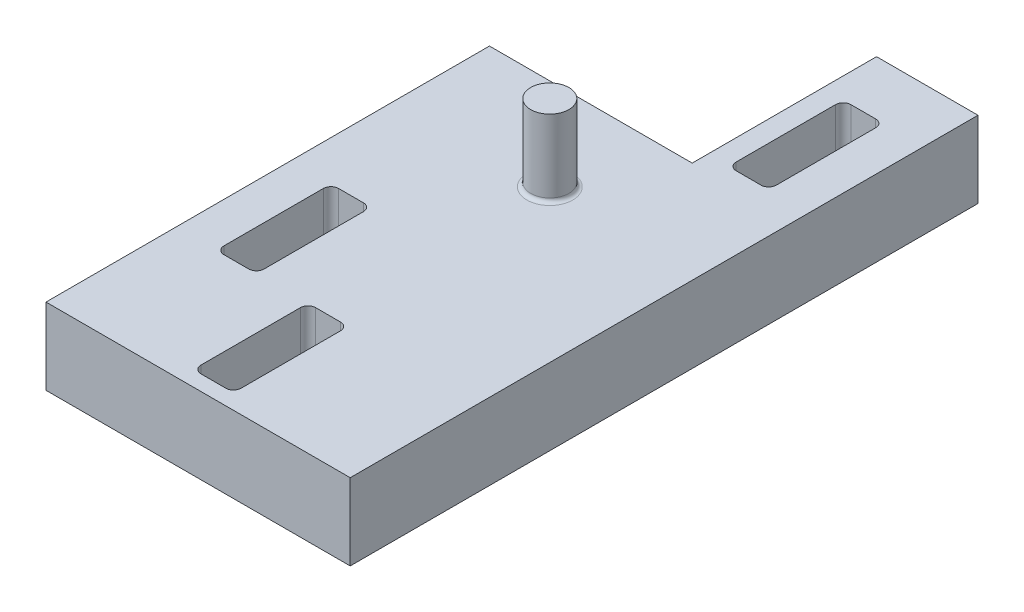
from build123d import *

# Parameters (mm, degrees)
BOSS_EXTRUDE1_DEPTH  = 10
FILLET2_R            = 1
FILLET2_OF_MIRROR1_R = 1
CUT_EXTRUDE1_DEPTH   = 81.635062113
FILLET3_R            = 1
SKETCH5_R            = 2.5
BOSS_EXTRUDE2_DEPTH  = 10
FILLET1_R            = 0.5
CUT_EXTRUDE2_DEPTH   = 10


with BuildPart() as part:
    # Sketch2 → Boss-Extrude1 (new body)
    with BuildSketch(Plane(origin=(0, 0, 0), x_dir=(1, 0, 0), z_dir=(0, 1, 0))):
        Polygon((-19.893799085, 77.5), (0, 77.5), (0, 75.5), (-2.625, 75.5), (-2.625, 73), (-2.625, 63), (-2.625, 60.5), (0, 60.5), (0, 60.375), (0, 2.5), (-2.625, 2.5), (-2.625, 0), (-2.625, -10), (-2.625, -12.5), (0, -12.5), (0, -14.5), (-19.893799085, -14.5), align=None)
    boss_extrude1 = extrude(amount=BOSS_EXTRUDE1_DEPTH)

    # Fillet2
    fillet2_edges = [part.edges().sort_by_distance(p)[0] for p in [
        (-2.625, 5, 12.5),
        (-2.625, 5, -2.5),
        (-2.625, 5, -60.5),
        (-2.625, 5, -75.5),
    ]]
    fillet(fillet2_edges, radius=FILLET2_R)

    # Mirror1: Boss-Extrude1 across Right Plane
    add(boss_extrude1.mirror(Plane(origin=(0, 0, 0), x_dir=(0, 0, -1), z_dir=(1, 0, 0))))

    # Fillet2 of Mirror1
    fillet2_of_mirror1_edges = [part.edges().sort_by_distance(p)[0] for p in [
        (2.625, 5, 12.5),
        (2.625, 5, -2.5),
        (2.625, 5, -60.5),
        (2.625, 5, -75.5),
    ]]
    fillet(fillet2_of_mirror1_edges, radius=FILLET2_OF_MIRROR1_R)

    # Sketch4 → Cut-Extrude1 (cut, through all)
    with BuildSketch(Plane(origin=(0, 0, 0), x_dir=(1, 0, 0), z_dir=(0, 1, 0))):
        Polygon((-14.625, 15), (-14.625, 5), (-14.625, 2.5), (-12, 2.5), (-9.375, 2.5), (-9.375, 5), (-9.375, 15), (-9.375, 17.5), (-12, 17.5), (-14.625, 17.5), align=None)
        Polygon((9.375, 58), (9.375, 48), (9.375, 45.5), (12, 45.5), (14.625, 45.5), (14.625, 48), (14.625, 58), (14.625, 60.5), (12, 60.5), (9.375, 60.5), align=None)
    extrude(amount=CUT_EXTRUDE1_DEPTH, mode=Mode.SUBTRACT)

    # Fillet3
    fillet3_edges = [part.edges().sort_by_distance(p)[0] for p in [
        (-14.625, 5, -17.5),
        (-14.625, 5, -2.5),
        (-9.375, 5, -2.5),
        (-9.375, 5, -17.5),
        (14.625, 5, -60.5),
        (9.375, 5, -60.5),
        (9.375, 5, -45.5),
        (14.625, 5, -45.5),
    ]]
    fillet(fillet3_edges, radius=FILLET3_R)

    # Sketch5 → Boss-Extrude2 (add)
    with BuildSketch(Plane(origin=(0, 10, 0), x_dir=(1, 0, 0), z_dir=(0, 1, 0))):
        with Locations(Location((0, 31.5, 0), (0, 0, 90))):
            Circle(SKETCH5_R)
    extrude(amount=BOSS_EXTRUDE2_DEPTH)

    # Fillet1
    fillet1_edges = [part.edges().sort_by_distance(p)[0] for p in [
        (0, 10, -29),
    ]]
    fillet(fillet1_edges, radius=FILLET1_R)

    # Sketch6 → Cut-Extrude2 (cut)
    with BuildSketch(Plane(origin=(0, 10, 0), x_dir=(1, 0, 0), z_dir=(0, 1, 0))):
        Polygon((19.893799085, 77.5), (19.893799085, 67.609192382), (6.623799085, 67.609192382), (6.623799085, 43.5), (-6.625, 43.5), (-19.893799085, 43.5), (-19.893799085, 77.5), (-6.625, 77.5), align=None)
    extrude(amount=-CUT_EXTRUDE2_DEPTH, mode=Mode.SUBTRACT)


solid = part.part
